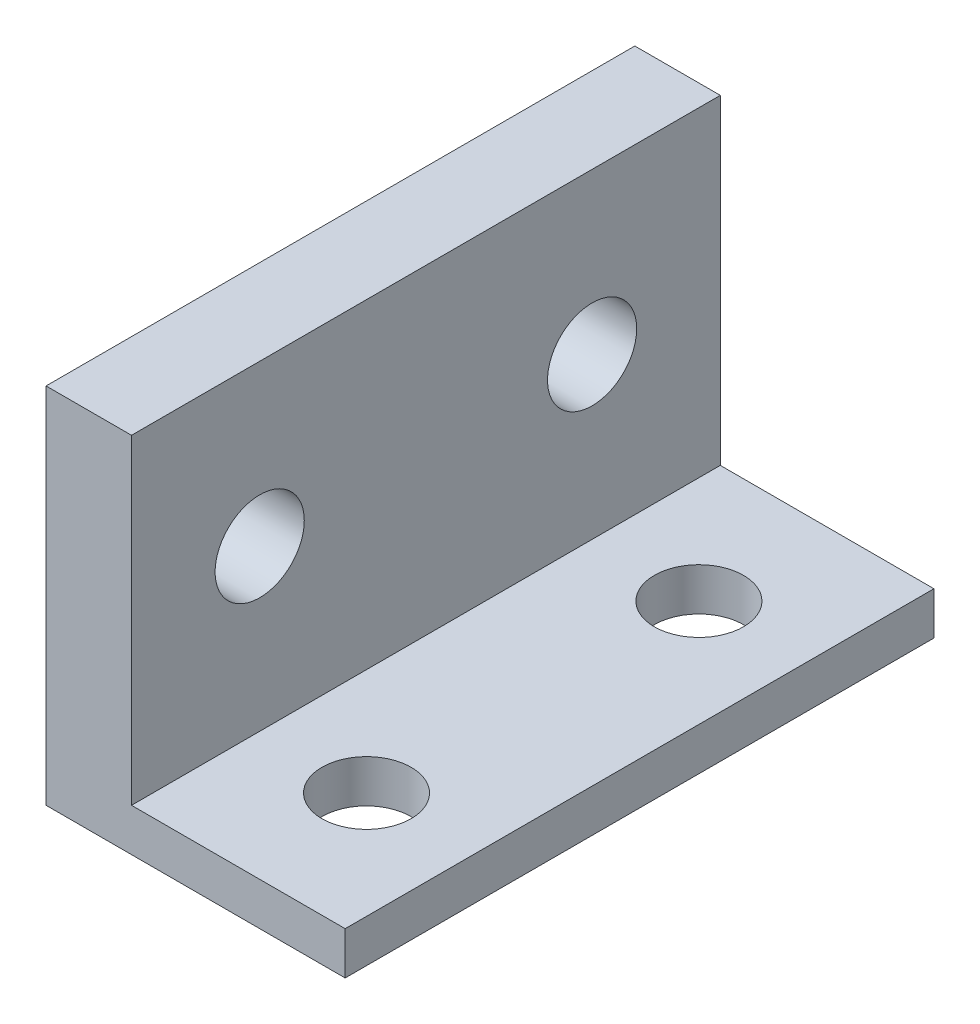
from build123d import *

# Parameters (mm, degrees)
SKETCH1_W             = 5.08
SKETCH1_H             = 19.05
BOSS_EXTRUDE1_DEPTH   = 35
F_5_0MM_DOWEL_HOLE1_D = 5.3
F_5_0MM_DOWEL_HOLE2_D = 5.3


with BuildPart() as part:
    # Sketch1 → Boss-Extrude1 (new body)
    with BuildSketch(Plane.XY):
        Polygon((0, 2.54), (0, 0), (17.78, 0), (17.78, 2.54), (5.08, 2.54), align=None)
        with Locations((2.54, 12.065)):
            Rectangle(SKETCH1_W, SKETCH1_H)
    extrude(amount=BOSS_EXTRUDE1_DEPTH)

    # Ø5.0mm Dowel Hole1 (through all)
    with Locations(Plane(origin=(5.08, 0, 0), x_dir=(0, 0, -1), z_dir=(1, 0, 0))):
        with Locations((-27.38, 12.065), (-7.62, 12.065)):
            Hole(F_5_0MM_DOWEL_HOLE1_D / 2)

    # Ø5.0mm Dowel Hole2 (through all)
    with Locations(Plane(origin=(0, 2.54, 0), x_dir=(1, 0, 0), z_dir=(0, 1, 0))):
        with Locations((11.43, -27.38), (11.43, -7.62)):
            Hole(F_5_0MM_DOWEL_HOLE2_D / 2)


solid = part.part
